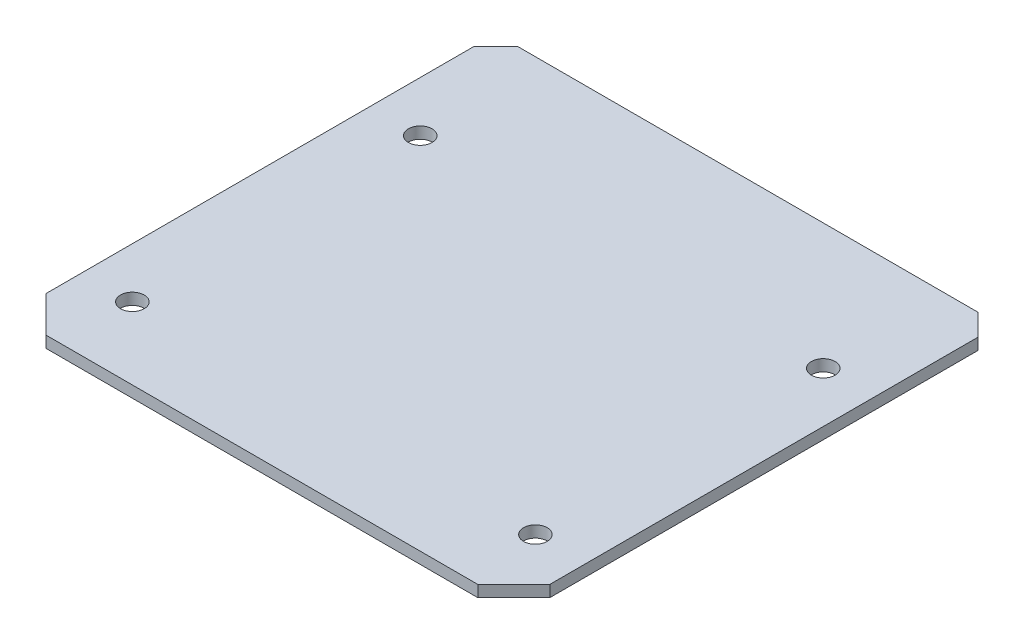
from build123d import *

# Parameters (mm, degrees)
SKETCH_1_W          = 70
SKETCH_1_H          = 50
EXTRUDE_1_DEPTH     = 1.6
CUT_EXTRUDE_1_REACH = 45.041
SKETCH_2_R          = 1.65
SKETCH_3_W          = 70
SKETCH_3_H          = 12.5
EXTRUDE_2_DEPTH     = 1.6
CHAMFER_1_SIZE      = 3


with BuildPart() as part:
    # 草图1 → 凸台-拉伸1 (new body)
    with BuildSketch(Plane(origin=(0, 0, 0), x_dir=(1, 0, 0), z_dir=(0, 1, 0))):
        Rectangle(SKETCH_1_W, SKETCH_1_H)
    extrude(amount=EXTRUDE_1_DEPTH)

    # 草图2 → 切除-拉伸1 (cut, up to next)
    with BuildSketch(Plane(origin=(0, 1.6, 0), x_dir=(1, 0, 0), z_dir=(0, 1, 0)), mode=Mode.PRIVATE) as cut_extrude_1_sk1:
        with Locations(Location((-28, 20, 0), (0, 0, 270))):
            Circle(SKETCH_2_R)
    cut_extrude_1_tool1 = extrude(cut_extrude_1_sk1.sketch, amount=-CUT_EXTRUDE_1_REACH, mode=Mode.PRIVATE) & part.part
    # 草图2 → 切除-拉伸1 (cut, up to next)
    with BuildSketch(Plane(origin=(0, 1.6, 0), x_dir=(1, 0, 0), z_dir=(0, 1, 0)), mode=Mode.PRIVATE) as cut_extrude_1_sk2:
        with Locations(Location((-28, -20, 0), (0, 0, 270))):
            Circle(SKETCH_2_R)
    cut_extrude_1_tool2 = extrude(cut_extrude_1_sk2.sketch, amount=-CUT_EXTRUDE_1_REACH, mode=Mode.PRIVATE) & part.part
    # 草图2 → 切除-拉伸1 (cut, up to next)
    with BuildSketch(Plane(origin=(0, 1.6, 0), x_dir=(1, 0, 0), z_dir=(0, 1, 0)), mode=Mode.PRIVATE) as cut_extrude_1_sk3:
        with Locations(Location((28, -20, 0), (0, 0, 270))):
            Circle(SKETCH_2_R)
    cut_extrude_1_tool3 = extrude(cut_extrude_1_sk3.sketch, amount=-CUT_EXTRUDE_1_REACH, mode=Mode.PRIVATE) & part.part
    # 草图2 → 切除-拉伸1 (cut, up to next)
    with BuildSketch(Plane(origin=(0, 1.6, 0), x_dir=(1, 0, 0), z_dir=(0, 1, 0)), mode=Mode.PRIVATE) as cut_extrude_1_sk4:
        with Locations(Location((28, 20, 0), (0, 0, 270))):
            Circle(SKETCH_2_R)
    cut_extrude_1_tool4 = extrude(cut_extrude_1_sk4.sketch, amount=-CUT_EXTRUDE_1_REACH, mode=Mode.PRIVATE) & part.part
    add(cut_extrude_1_tool1.solids().sort_by_distance((-28, 1.6, -20))[0], mode=Mode.SUBTRACT)
    add(cut_extrude_1_tool2.solids().sort_by_distance((-28, 1.6, 20))[0], mode=Mode.SUBTRACT)
    add(cut_extrude_1_tool3.solids().sort_by_distance((28, 1.6, 20))[0], mode=Mode.SUBTRACT)
    add(cut_extrude_1_tool4.solids().sort_by_distance((28, 1.6, -20))[0], mode=Mode.SUBTRACT)

    # 草图3 → 凸台-拉伸2 (add)
    with BuildSketch(Plane(origin=(0, 0, 0), x_dir=(1, 0, 0), z_dir=(0, 1, 0))):
        Polygon((-35, -25), (-30, -30), (30, -30), (35, -25), align=None)
        with Locations((0, 31.25)):
            Rectangle(SKETCH_3_W, SKETCH_3_H)
    extrude(amount=EXTRUDE_2_DEPTH)

    # 倒角1
    chamfer_1_edges = [part.edges().sort_by_distance(p)[0] for p in [
        (35, 0.8, -37.5),
        (-35, 0.8, -37.5),
    ]]
    chamfer(chamfer_1_edges, length=CHAMFER_1_SIZE)


solid = part.part
